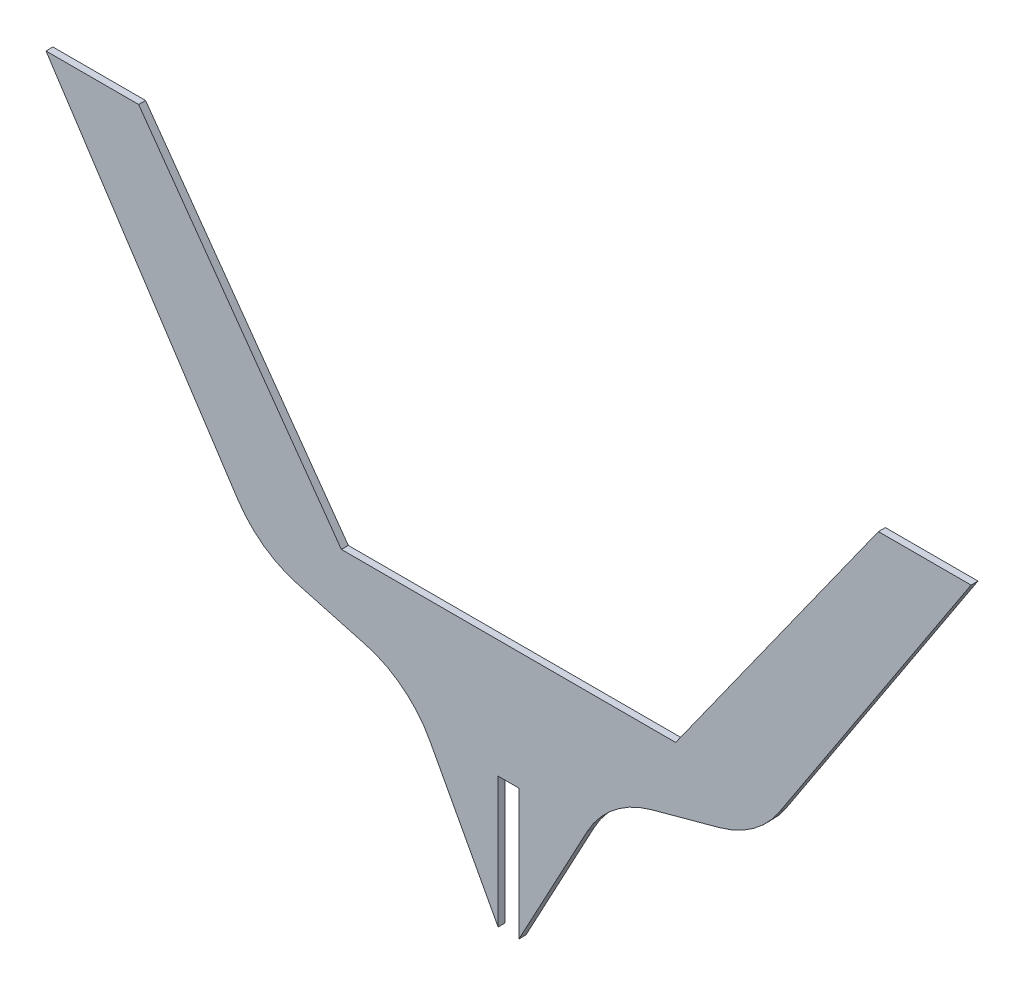
from build123d import *

# Parameters (mm, degrees)
BOSS_EXTRU_3_DEPTH = 3
CONG_1_R           = 45


with BuildPart() as part:
    # Esquisse3 → Boss.-Extru.3 (new body)
    with BuildSketch(Plane.XY):
        Polygon((45.510078794, -47.778138889), (133.182013931, -170.571691484), (277.734842334, -170.571691484), (365.406777472, -47.778138889), (405.458428133, -47.778138889), (313.167585376, -188.51956808), (248.604786318, -206.078138889), (209.958428133, -278.078138889), (209.958428133, -221.578138889), (200.958428133, -221.578138889), (200.958428133, -278.078138889), (162.312069948, -206.078138889), (97.749270889, -188.51956808), (5.458428133, -47.778138889), align=None)
    extrude(amount=BOSS_EXTRU_3_DEPTH)

    # Congé1
    cong_1_edges = [part.edges().sort_by_distance(p)[0] for p in [
        (162.312069948, -206.078138889, 1.5),
        (97.749270889, -188.51956808, 1.5),
        (313.167585376, -188.51956808, 1.5),
        (248.604786318, -206.078138889, 1.5),
    ]]
    fillet(cong_1_edges, radius=CONG_1_R)


solid = part.part
